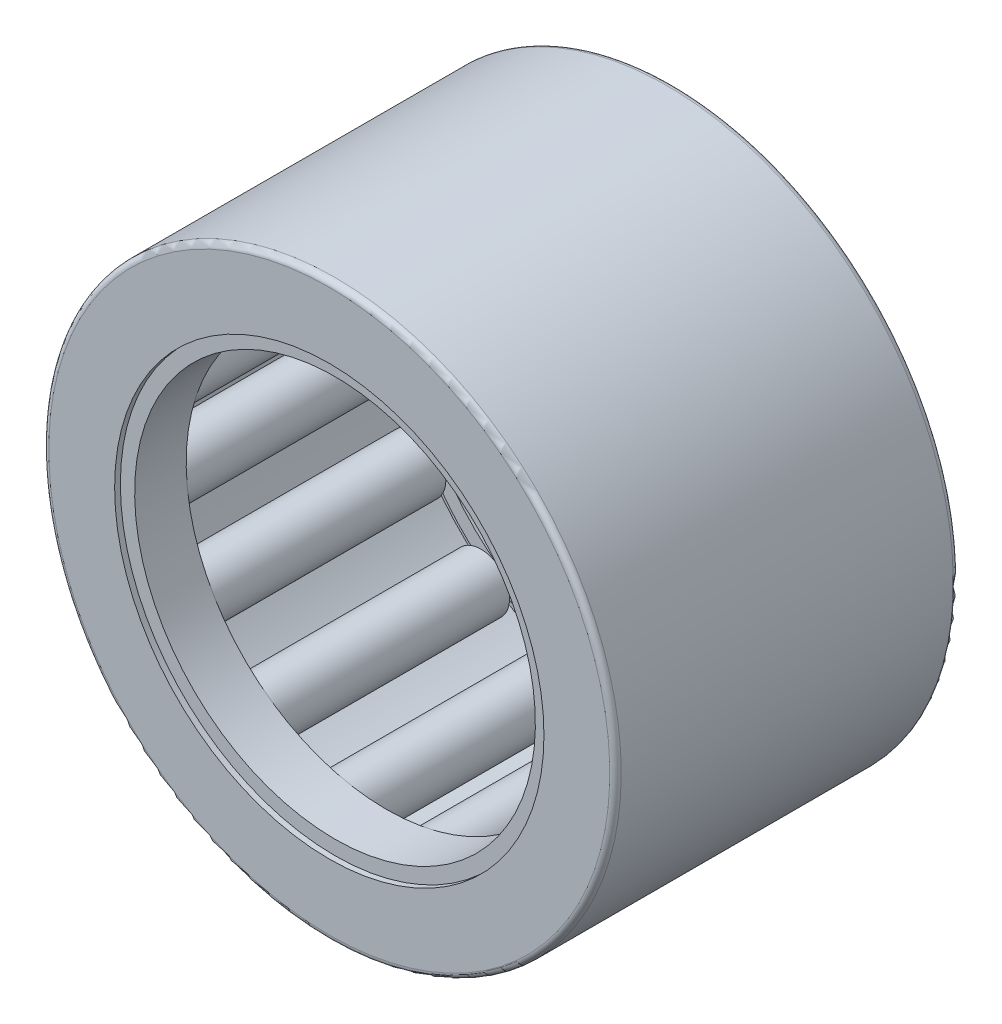
from build123d import *

# Parameters (mm, degrees)
SKETCH2_W         = 8
SKETCH2_H         = 0.75
SKETCH3_W         = 10
SKETCH3_H         = 0.25
CIRPATTERN1_COUNT = 15
CIRPATTERN1_ANGLE = 336
FILLET1_R         = 0.2
SKETCH4_W         = 1.8
SKETCH4_H         = 0.5
SKETCH5_W         = 1.8
SKETCH5_H         = 0.5


with BuildPart() as part:
    # Sketch7 → Revolve1 (revolve)
    with BuildSketch(Plane(origin=(0, 0, 0), x_dir=(0, 0, -1), z_dir=(1, 0, 0)), mode=Mode.PRIVATE) as revolve1_sk:
        Polygon((-6, 10), (-6, 7.5), (-5, 7.5), (-5, 9), (5, 9), (5, 7.5), (6, 7.5), (6, 10), align=None)
    revolve(revolve1_sk.sketch.rotate(Axis((0, 0, 6), (0, 0, -1)), 180), axis=Axis((0, 0, 6), (0, 0, -1)))

    # Fillet1
    fillet1_edges = [part.edges().sort_by_distance(p)[0] for p in [
        (0, 10, -6),
        (0, 10, 6),
    ]]
    fillet(fillet1_edges, radius=FILLET1_R)


with BuildPart() as body_2:
    # Sketch2 → Revolve2 (revolve)
    with BuildSketch(Plane(origin=(0, 0, 0), x_dir=(0, 0, -1), z_dir=(1, 0, 0)), mode=Mode.PRIVATE) as revolve2_sk:
        with Locations((0, 8.625)):
            Rectangle(SKETCH2_W, SKETCH2_H)
    revolve(revolve2_sk.sketch.rotate(Axis((0, 8, 4), (0, 0, -1)), 180), axis=Axis((0, 8, 4), (0, 0, -1)))


with BuildPart() as body_3:
    # Sketch3 → Revolve3 (revolve)
    with BuildSketch(Plane(origin=(0, 0, 0), x_dir=(0, 0, -1), z_dir=(1, 0, 0)), mode=Mode.PRIVATE) as revolve3_sk:
        with Locations((0, 8.125)):
            Rectangle(SKETCH3_W, SKETCH3_H)
    revolve(revolve3_sk.sketch.rotate(Axis((0, 8, 5), (0, 0, -1)), 90), axis=Axis((0, 8, 5), (0, 0, -1)))


with BuildPart() as cirpattern1_1:
    # CirPattern1: pattern copy
    add(body_2.part.rotate(Axis((0, 0, 6), (0, 0, -1)), 1 * CIRPATTERN1_ANGLE / (CIRPATTERN1_COUNT - 1)))


with BuildPart() as cirpattern1_2:
    # CirPattern1: pattern copy
    add(body_2.part.rotate(Axis((0, 0, 6), (0, 0, -1)), 2 * CIRPATTERN1_ANGLE / (CIRPATTERN1_COUNT - 1)))


with BuildPart() as cirpattern1_3:
    # CirPattern1: pattern copy
    add(body_2.part.rotate(Axis((0, 0, 6), (0, 0, -1)), 3 * CIRPATTERN1_ANGLE / (CIRPATTERN1_COUNT - 1)))


with BuildPart() as cirpattern1_4:
    # CirPattern1: pattern copy
    add(body_2.part.rotate(Axis((0, 0, 6), (0, 0, -1)), 4 * CIRPATTERN1_ANGLE / (CIRPATTERN1_COUNT - 1)))


with BuildPart() as cirpattern1_5:
    # CirPattern1: pattern copy
    add(body_2.part.rotate(Axis((0, 0, 6), (0, 0, -1)), 5 * CIRPATTERN1_ANGLE / (CIRPATTERN1_COUNT - 1)))


with BuildPart() as cirpattern1_6:
    # CirPattern1: pattern copy
    add(body_2.part.rotate(Axis((0, 0, 6), (0, 0, -1)), 6 * CIRPATTERN1_ANGLE / (CIRPATTERN1_COUNT - 1)))


with BuildPart() as cirpattern1_7:
    # CirPattern1: pattern copy
    add(body_2.part.rotate(Axis((0, 0, 6), (0, 0, -1)), 7 * CIRPATTERN1_ANGLE / (CIRPATTERN1_COUNT - 1)))


with BuildPart() as cirpattern1_8:
    # CirPattern1: pattern copy
    add(body_2.part.rotate(Axis((0, 0, 6), (0, 0, -1)), 8 * CIRPATTERN1_ANGLE / (CIRPATTERN1_COUNT - 1)))


with BuildPart() as cirpattern1_9:
    # CirPattern1: pattern copy
    add(body_2.part.rotate(Axis((0, 0, 6), (0, 0, -1)), 9 * CIRPATTERN1_ANGLE / (CIRPATTERN1_COUNT - 1)))


with BuildPart() as cirpattern1_10:
    # CirPattern1: pattern copy
    add(body_2.part.rotate(Axis((0, 0, 6), (0, 0, -1)), 10 * CIRPATTERN1_ANGLE / (CIRPATTERN1_COUNT - 1)))


with BuildPart() as cirpattern1_11:
    # CirPattern1: pattern copy
    add(body_2.part.rotate(Axis((0, 0, 6), (0, 0, -1)), 11 * CIRPATTERN1_ANGLE / (CIRPATTERN1_COUNT - 1)))


with BuildPart() as cirpattern1_12:
    # CirPattern1: pattern copy
    add(body_2.part.rotate(Axis((0, 0, 6), (0, 0, -1)), 12 * CIRPATTERN1_ANGLE / (CIRPATTERN1_COUNT - 1)))


with BuildPart() as cirpattern1_13:
    # CirPattern1: pattern copy
    add(body_2.part.rotate(Axis((0, 0, 6), (0, 0, -1)), 13 * CIRPATTERN1_ANGLE / (CIRPATTERN1_COUNT - 1)))


with BuildPart() as cirpattern1_14:
    # CirPattern1: pattern copy
    add(body_2.part.rotate(Axis((0, 0, 6), (0, 0, -1)), 14 * CIRPATTERN1_ANGLE / (CIRPATTERN1_COUNT - 1)))


with BuildPart() as cirpattern1_15:
    # CirPattern1: pattern copy
    add(body_3.part.rotate(Axis((0, 0, 6), (0, 0, -1)), 1 * CIRPATTERN1_ANGLE / (CIRPATTERN1_COUNT - 1)))


with BuildPart() as cirpattern1_16:
    # CirPattern1: pattern copy
    add(body_3.part.rotate(Axis((0, 0, 6), (0, 0, -1)), 2 * CIRPATTERN1_ANGLE / (CIRPATTERN1_COUNT - 1)))


with BuildPart() as cirpattern1_17:
    # CirPattern1: pattern copy
    add(body_3.part.rotate(Axis((0, 0, 6), (0, 0, -1)), 3 * CIRPATTERN1_ANGLE / (CIRPATTERN1_COUNT - 1)))


with BuildPart() as cirpattern1_18:
    # CirPattern1: pattern copy
    add(body_3.part.rotate(Axis((0, 0, 6), (0, 0, -1)), 4 * CIRPATTERN1_ANGLE / (CIRPATTERN1_COUNT - 1)))


with BuildPart() as cirpattern1_19:
    # CirPattern1: pattern copy
    add(body_3.part.rotate(Axis((0, 0, 6), (0, 0, -1)), 5 * CIRPATTERN1_ANGLE / (CIRPATTERN1_COUNT - 1)))


with BuildPart() as cirpattern1_20:
    # CirPattern1: pattern copy
    add(body_3.part.rotate(Axis((0, 0, 6), (0, 0, -1)), 6 * CIRPATTERN1_ANGLE / (CIRPATTERN1_COUNT - 1)))


with BuildPart() as cirpattern1_21:
    # CirPattern1: pattern copy
    add(body_3.part.rotate(Axis((0, 0, 6), (0, 0, -1)), 7 * CIRPATTERN1_ANGLE / (CIRPATTERN1_COUNT - 1)))


with BuildPart() as cirpattern1_22:
    # CirPattern1: pattern copy
    add(body_3.part.rotate(Axis((0, 0, 6), (0, 0, -1)), 8 * CIRPATTERN1_ANGLE / (CIRPATTERN1_COUNT - 1)))


with BuildPart() as cirpattern1_23:
    # CirPattern1: pattern copy
    add(body_3.part.rotate(Axis((0, 0, 6), (0, 0, -1)), 9 * CIRPATTERN1_ANGLE / (CIRPATTERN1_COUNT - 1)))


with BuildPart() as cirpattern1_24:
    # CirPattern1: pattern copy
    add(body_3.part.rotate(Axis((0, 0, 6), (0, 0, -1)), 10 * CIRPATTERN1_ANGLE / (CIRPATTERN1_COUNT - 1)))


with BuildPart() as cirpattern1_25:
    # CirPattern1: pattern copy
    add(body_3.part.rotate(Axis((0, 0, 6), (0, 0, -1)), 11 * CIRPATTERN1_ANGLE / (CIRPATTERN1_COUNT - 1)))


with BuildPart() as cirpattern1_26:
    # CirPattern1: pattern copy
    add(body_3.part.rotate(Axis((0, 0, 6), (0, 0, -1)), 12 * CIRPATTERN1_ANGLE / (CIRPATTERN1_COUNT - 1)))


with BuildPart() as cirpattern1_27:
    # CirPattern1: pattern copy
    add(body_3.part.rotate(Axis((0, 0, 6), (0, 0, -1)), 13 * CIRPATTERN1_ANGLE / (CIRPATTERN1_COUNT - 1)))


with BuildPart() as cirpattern1_28:
    # CirPattern1: pattern copy
    add(body_3.part.rotate(Axis((0, 0, 6), (0, 0, -1)), 14 * CIRPATTERN1_ANGLE / (CIRPATTERN1_COUNT - 1)))


with BuildPart() as body_32:
    # Sketch4 → Revolve4 (revolve)
    with BuildSketch(Plane(origin=(0, 0, 0), x_dir=(0, 0, -1), z_dir=(1, 0, 0)), mode=Mode.PRIVATE) as revolve4_sk:
        with Locations((4.9, 7.25)):
            Rectangle(SKETCH4_W, SKETCH4_H)
    revolve(revolve4_sk.sketch.rotate(Axis((0, 0, 6), (0, 0, -1)), 180), axis=Axis((0, 0, 6), (0, 0, -1)))


with BuildPart() as body_33:
    # Sketch5 → Revolve5 (revolve)
    with BuildSketch(Plane(origin=(0, 0, 0), x_dir=(0, 0, -1), z_dir=(1, 0, 0)), mode=Mode.PRIVATE) as revolve5_sk:
        with Locations((-4.9, 7.25)):
            Rectangle(SKETCH5_W, SKETCH5_H)
    revolve(revolve5_sk.sketch.rotate(Axis((0, 0, 6), (0, 0, -1)), 180), axis=Axis((0, 0, 6), (0, 0, -1)))


solid = Compound([part.part, body_2.part, body_3.part, cirpattern1_1.part, cirpattern1_2.part, cirpattern1_3.part, cirpattern1_4.part, cirpattern1_5.part, cirpattern1_6.part, cirpattern1_7.part, cirpattern1_8.part, cirpattern1_9.part, cirpattern1_10.part, cirpattern1_11.part, cirpattern1_12.part, cirpattern1_13.part, cirpattern1_14.part, cirpattern1_15.part, cirpattern1_16.part, cirpattern1_17.part, cirpattern1_18.part, cirpattern1_19.part, cirpattern1_20.part, cirpattern1_21.part, cirpattern1_22.part, cirpattern1_23.part, cirpattern1_24.part, cirpattern1_25.part, cirpattern1_26.part, cirpattern1_27.part, cirpattern1_28.part, body_32.part, body_33.part])
